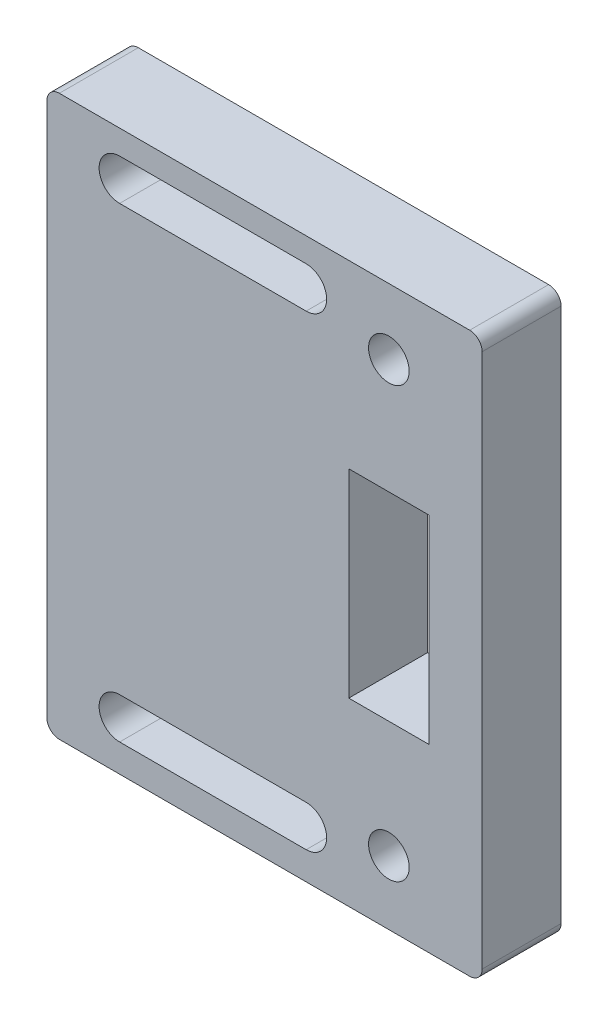
from build123d import *

# Parameters (mm, degrees)
SKETCH1_W                                        = 70
SKETCH1_H                                        = 90
BOSS_EXTRUDE1_DEPTH                              = 12.7
CSK_FOR_1_4_FLAT_HEAD_MACHINE_SCREW1_D           = 6.5278
CSK_FOR_1_4_FLAT_HEAD_MACHINE_SCREW1_CSINK_D     = 12.8778
CSK_FOR_1_4_FLAT_HEAD_MACHINE_SCREW1_CSINK_ANGLE = 82
FILLET1_R                                        = 2
CUT_EXTRUDE1_DEPTH                               = 115.72266559


with BuildPart() as part:
    # Sketch1 → Boss-Extrude1 (new body)
    with BuildSketch(Plane.XY):
        with Locations((35, -45)):
            Rectangle(SKETCH1_W, SKETCH1_H)
        Polygon((55, -29.025), (61.45, -29.025), (61.45, -60.975), (55, -60.975), (48.55, -60.975), (48.55, -29.025), align=None, mode=Mode.SUBTRACT)
    extrude(amount=BOSS_EXTRUDE1_DEPTH)

    # CSK for 1/4 Flat Head Machine Screw1 (through all)
    with Locations(Plane(origin=(0, 0, 0), x_dir=(-1, 0, 0), z_dir=(0, 0, -1))):
        with Locations((-55, -10.579610023), (-55, -79.699610023)):
            CounterSinkHole(CSK_FOR_1_4_FLAT_HEAD_MACHINE_SCREW1_D / 2, CSK_FOR_1_4_FLAT_HEAD_MACHINE_SCREW1_CSINK_D / 2, counter_sink_angle=CSK_FOR_1_4_FLAT_HEAD_MACHINE_SCREW1_CSINK_ANGLE)

    # Fillet1
    fillet1_edges = [part.edges().sort_by_distance(p)[0] for p in [
        (0, 0, 6.35),
        (70, 0, 6.35),
        (70, -90, 6.35),
        (0, -90, 6.35),
    ]]
    fillet(fillet1_edges, radius=FILLET1_R)

    # Sketch7 → Cut-Extrude1 (cut, through all)
    with BuildSketch(Plane(origin=(0, 0, 0), x_dir=(-1, 0, 0), z_dir=(0, 0, -1))):
        with BuildLine():
            Line((-41.695527842, -85.513384119), (-11.695527842, -85.513384119))
            ThreePointArc((-11.695527842, -85.513384119), (-8.395527842, -82.213384119), (-11.695527842, -78.913384119))
            Line((-11.695527842, -78.913384119), (-41.695527842, -78.913384119))
            ThreePointArc((-41.695527842, -78.913384119), (-44.995527842, -82.213384119), (-41.695527842, -85.513384119))
        make_face()
        with BuildLine():
            Line((-11.695527842, -10.493384119), (-41.695527842, -10.493384119))
            ThreePointArc((-41.695527842, -10.493384119), (-44.995527842, -7.193384119), (-41.695527842, -3.893384119))
            Line((-41.695527842, -3.893384119), (-11.695527842, -3.893384119))
            ThreePointArc((-11.695527842, -3.893384119), (-8.395527842, -7.193384119), (-11.695527842, -10.493384119))
        make_face()
    extrude(amount=-CUT_EXTRUDE1_DEPTH, mode=Mode.SUBTRACT)


solid = part.part
